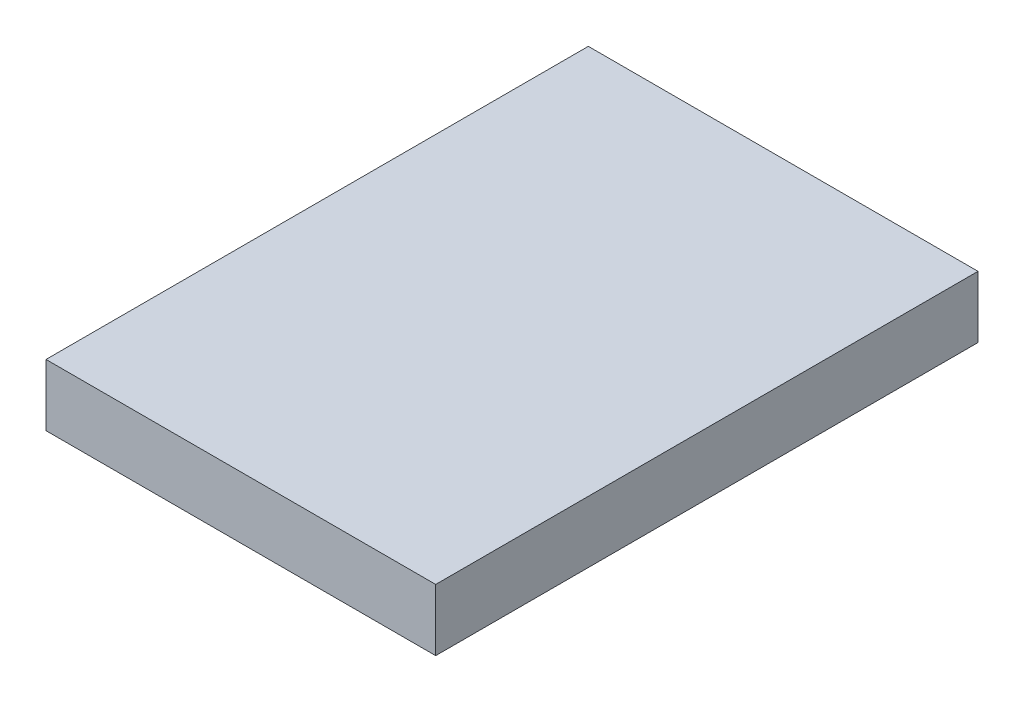
from build123d import *

# Parameters (mm, degrees)
SKETCH_2_W      = 60
SKETCH_2_H      = 83.5
EXTRUDE_1_DEPTH = 9.5


with BuildPart() as part:
    # 草图2 → 凸台-拉伸1 (new body)
    with BuildSketch(Plane(origin=(0, 0, 0), x_dir=(1, 0, 0), z_dir=(0, 1, 0))):
        with Locations((30, -41.75)):
            Rectangle(SKETCH_2_W, SKETCH_2_H)
    extrude(amount=EXTRUDE_1_DEPTH)


solid = part.part
